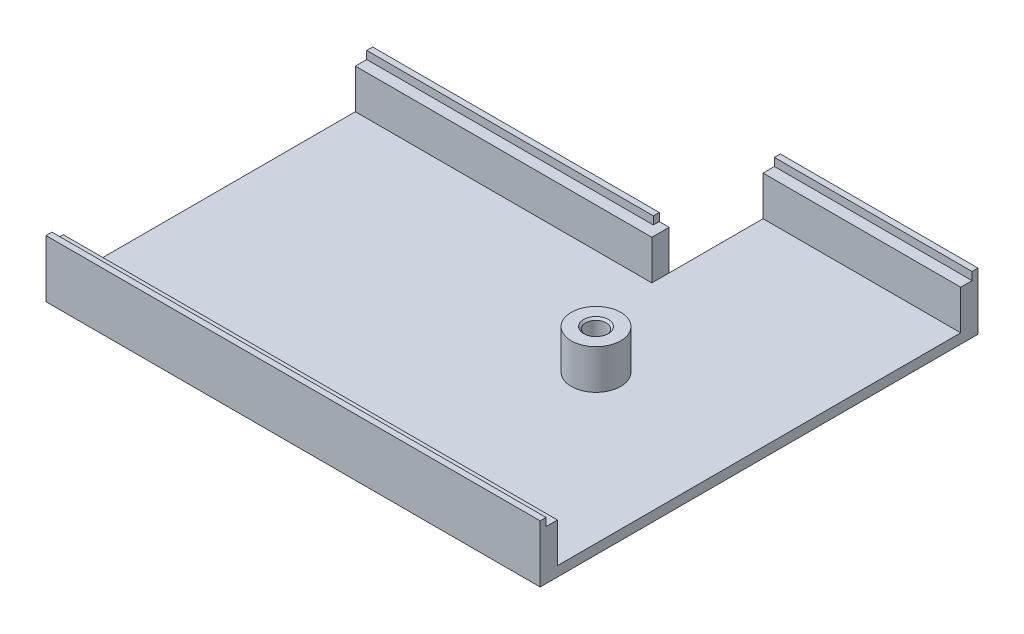
from build123d import *

# Parameters (mm, degrees)
AUFSATZ_LINEAR_AUSTRAGEN1_DEPTH = 2
SKIZZE2_R                       = 5
SKIZZE2_W                       = 60
SKIZZE2_H                       = 3.5
SKIZZE2_W_2                     = 40
SKIZZE2_W_3                     = 100
AUFSATZ_LINEAR_AUSTRAGEN2_DEPTH = 8
SKIZZE3_R                       = 2.1
SCHNITT_LINEAR_AUSTRAGEN1_DEPTH = 9
FASE1_SIZE                      = 0.4
SKIZZE4_W                       = 58
SKIZZE4_H                       = 1.2
SKIZZE4_W_2                     = 40
SKIZZE4_W_3                     = 100
AUFSATZ_LINEAR_AUSTRAGEN3_DEPTH = 1.6


with BuildPart() as part:
    # Skizze1 → Aufsatz-Linear austragen1 (new body)
    with BuildSketch(Plane(origin=(0, 0, 0), x_dir=(1, 0, 0), z_dir=(0, 1, 0))):
        Polygon((0, 66.1), (0, 0), (100, 0), (100, 88.6), (60, 88.6), (60, 66.1), align=None)
    extrude(amount=AUFSATZ_LINEAR_AUSTRAGEN1_DEPTH)

    # Skizze2 → Aufsatz-Linear austragen2 (add)
    with BuildSketch(Plane(origin=(0, 2, 0), x_dir=(1, 0, 0), z_dir=(0, 1, 0))):
        with Locations(Location((70, 41.3, 0), (0, 0, 270))):
            Circle(SKIZZE2_R)
        with Locations((30, 64.35)):
            Rectangle(SKIZZE2_W, SKIZZE2_H)
        with Locations((80, 86.85)):
            Rectangle(SKIZZE2_W_2, SKIZZE2_H)
        with Locations((50, 1.75)):
            Rectangle(SKIZZE2_W_3, SKIZZE2_H)
    extrude(amount=AUFSATZ_LINEAR_AUSTRAGEN2_DEPTH)

    # Skizze3 → Schnitt-Linear austragen1 (cut)
    with BuildSketch(Plane(origin=(0, 10, 0), x_dir=(1, 0, 0), z_dir=(0, 1, 0))):
        with Locations(Location((70, 41.3, 0), (0, 0, 270))):
            Circle(SKIZZE3_R)
    extrude(amount=-SCHNITT_LINEAR_AUSTRAGEN1_DEPTH, mode=Mode.SUBTRACT)

    # Fase1
    fase1_edges = [part.edges().sort_by_distance(p)[0] for p in [
        (70, 10, -43.4),
    ]]
    chamfer(fase1_edges, length=FASE1_SIZE)

    # Skizze4 → Aufsatz-Linear austragen3 (add)
    with BuildSketch(Plane(origin=(0, 10, 0), x_dir=(1, 0, 0), z_dir=(0, 1, 0))):
        with Locations((29, 65.5)):
            Rectangle(SKIZZE4_W, SKIZZE4_H)
        with Locations((80, 88)):
            Rectangle(SKIZZE4_W_2, SKIZZE4_H)
        with Locations((50, 0.6)):
            Rectangle(SKIZZE4_W_3, SKIZZE4_H)
    extrude(amount=AUFSATZ_LINEAR_AUSTRAGEN3_DEPTH)


solid = part.part
